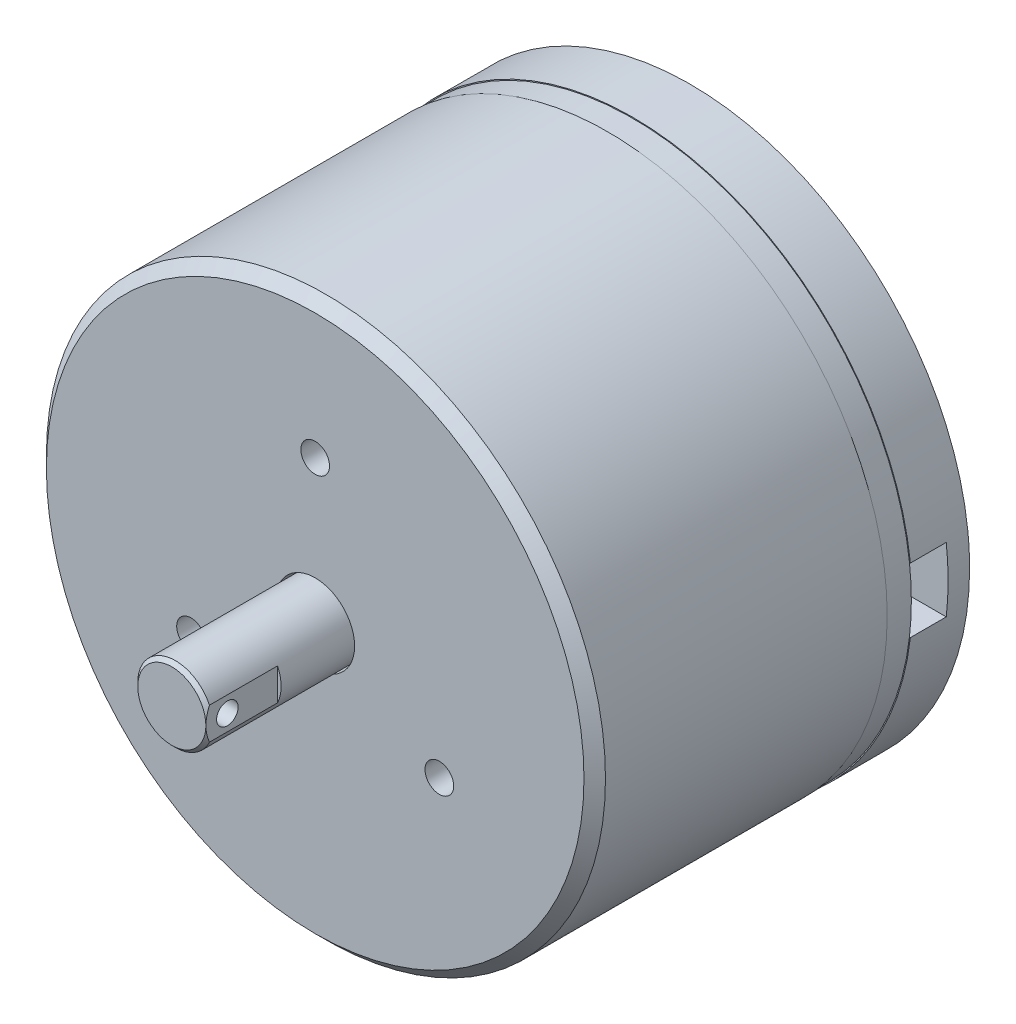
from build123d import *

# Parameters (mm, degrees)
SKETCH_1_R          = 39
EXTRUDE_1_DEPTH     = 53.8
SKETCH_2_R          = 2
CUT_EXTRUDE_1_DEPTH = 3
SKETCH_3_R          = 5.25
EXTRUDE_2_DEPTH     = 20
CUT_EXTRUDE_START   = -10
SKETCH_4_R          = 5.5
SKETCH_4_R_2        = 5.25
CUT_EXTRUDE_2_DEPTH = 10
CHAMFER_1_SIZE      = 0.5
CUT_EXTRUDE_3_DEPTH = 10
CHAMFER_2_SIZE      = 1.5
SKETCH_7_W          = 5
SKETCH_7_H          = 9
CUT_EXTRUDE_4_DEPTH = 10
SKETCH_8_W          = 0.130242645
SKETCH_8_H          = 3.5
SKETCH_9_R          = 1.5
CUT_EXTRUDE_5_DEPTH = 10


with BuildPart() as part:
    # 草图1 → 凸台-拉伸1 (new body)
    with BuildSketch(Plane.XY):
        with Locations(Location((0, 0, 0), (0, 0, 180))):
            Circle(SKETCH_1_R)
    extrude(amount=EXTRUDE_1_DEPTH)

    # 草图2 → 切除-拉伸1 (cut)
    with BuildSketch(Plane.XY.offset(53.8)):
        with Locations((0, 20)):
            Circle(SKETCH_2_R)
        with Locations((17.320508076, -10)):
            Circle(SKETCH_2_R)
        with Locations((-17.320508076, -10)):
            Circle(SKETCH_2_R)
    extrude(amount=-CUT_EXTRUDE_1_DEPTH, mode=Mode.SUBTRACT)

    # 草图3 → 凸台-拉伸2 (add)
    with BuildSketch(Plane.XY.offset(53.8)):
        Circle(SKETCH_3_R)
    extrude(amount=EXTRUDE_2_DEPTH)

    # 草图4 → 切除-拉伸2 (cut)
    with BuildSketch(Plane.XY.offset(53.8).offset(CUT_EXTRUDE_START)):
        Circle(SKETCH_4_R)
        Circle(SKETCH_4_R_2, mode=Mode.SUBTRACT)
    extrude(amount=CUT_EXTRUDE_2_DEPTH, mode=Mode.SUBTRACT)

    # 倒角1
    chamfer_1_edges = [part.edges().sort_by_distance(p)[0] for p in [
        (-5.25, 0, 73.8),
    ]]
    chamfer(chamfer_1_edges, length=CHAMFER_1_SIZE)

    # 草图5 → 切除-拉伸3 (cut)
    with BuildSketch(Plane.XY.offset(73.8)):
        Polygon((4.75, 0), (4.75, 11.306536843), (10.594936623, 11.306536843), (10.594936623, -9.408936254), (4.75, -9.408936254), align=None)
    extrude(amount=-CUT_EXTRUDE_3_DEPTH, mode=Mode.SUBTRACT)

    # 倒角2
    chamfer_2_edges = [part.edges().sort_by_distance(p)[0] for p in [
        (39, 0, 53.8),
    ]]
    chamfer(chamfer_2_edges, length=CHAMFER_2_SIZE)

    # 草图6 → 切除-旋转1 (revolve, cut)
    with BuildSketch(Plane(origin=(0, 0, 0), x_dir=(1, 0, 0), z_dir=(0, 1, 0)), mode=Mode.PRIVATE) as cut_revolve_1_sk:
        Polygon((-39, 0), (-39, -1.5), (-33.508685112, 0), align=None)
    revolve(cut_revolve_1_sk.sketch.rotate(Axis((0, 0, 0), (0, 0, -1)), 154.791234703), axis=Axis((0, 0, 0), (0, 0, -1)), mode=Mode.SUBTRACT)

    # 草图7 → 切除-拉伸4 (cut)
    with BuildSketch(Plane(origin=(40, 0, 0), x_dir=(0, 0, -1), z_dir=(1, 0, 0))):
        with Locations((-7, 0)):
            Rectangle(SKETCH_7_W, SKETCH_7_H)
    extrude(amount=-CUT_EXTRUDE_4_DEPTH, mode=Mode.SUBTRACT)

    # 草图8 → 切除-旋转2 (revolve, cut)
    with BuildSketch(Plane(origin=(0, 0, 0), x_dir=(1, 0, 0), z_dir=(0, 1, 0)), mode=Mode.PRIVATE) as cut_revolve_2_sk:
        with Locations((38.934878678, -11.25)):
            Rectangle(SKETCH_8_W, SKETCH_8_H)
    revolve(cut_revolve_2_sk.sketch.rotate(Axis((0, 0, 0), (0, 0, 1)), 25.208765297), axis=Axis((0, 0, 0), (0, 0, 1)), mode=Mode.SUBTRACT)

    # 草图9 → 切除-拉伸5 (cut)
    with BuildSketch(Plane(origin=(4.75, 0, 0), x_dir=(0, 0, -1), z_dir=(1, 0, 0))):
        with Locations((-70.8, 0)):
            Circle(SKETCH_9_R)
    extrude(amount=-CUT_EXTRUDE_5_DEPTH, mode=Mode.SUBTRACT)


solid = part.part
